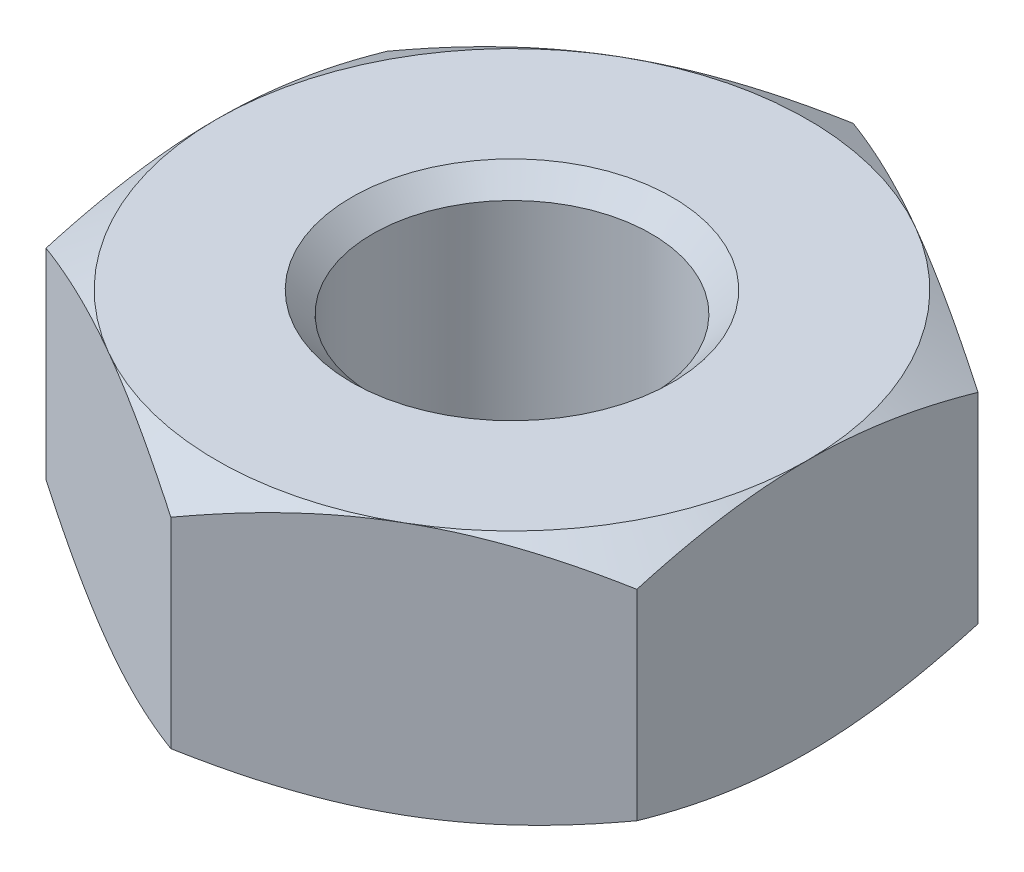
from build123d import *

# Parameters (mm, degrees)
BOSS_EXTRUDE1_DEPTH     = 1.5
SKETCH2_OUTSIDE_W       = 19.534
SKETCH2_OUTSIDE_H       = 20.616
SKETCH2_OUTSIDE_R       = 3.5
CUT_EXTRUDE1_DEPTH      = 2.4
CUT_EXTRUDE1_DRAFT      = -60
MIRROR1_COPY_1_SKETCH_W = 19.534
MIRROR1_COPY_1_SKETCH_H = 20.616
MIRROR1_COPY_1_SKETCH_R = 3.5
MIRROR1_COPY_1_DEPTH    = 2.4
MIRROR1_COPY_1_DRAFT    = -60
TAPPED_HOLE1_D          = 3.3
CHAMFER1_SIZE           = 0.25


with BuildPart() as part:
    # Sketch1 → Boss-Extrude1 (new, symmetric)
    with BuildSketch(Plane(origin=(0, 0, 0), x_dir=(1, 0, 0), z_dir=(0, 1, 0))):
        Polygon((3.5, -2.020725942), (3.5, 2.020725942), (0, 4.041451884), (-3.5, 2.020725942), (-3.5, -2.020725942), (0, -4.041451884), align=None)
    extrude(amount=BOSS_EXTRUDE1_DEPTH, both=True)


with BuildPart() as cut_extrude1_tool:
    # Sketch2 outside → Cut-Extrude1 (with draft: the straight prism first)
    with BuildSketch(Plane(origin=(0, 1.5, 0), x_dir=(1, 0, 0), z_dir=(0, 1, 0))):
        Rectangle(SKETCH2_OUTSIDE_W, SKETCH2_OUTSIDE_H)
        Circle(SKETCH2_OUTSIDE_R, mode=Mode.SUBTRACT)
    extrude(amount=-CUT_EXTRUDE1_DEPTH)
    # Cut-Extrude1: the draft: its side faces are tilted about the plane it starts from
    cut_extrude1_sides = [cut_extrude1_tool.faces().sort_by_distance(p)[0] for p in [
        (0, 0.3, 10.308),
        (9.767, 0.3, 0),
        (0, 0.3, -10.308),
        (-9.767, 0.3, 0),
        (-3.5, 0.3, 0),
    ]]
    draft(cut_extrude1_sides, Plane(origin=(0, 1.5, 0), x_dir=(1, 0, 0), z_dir=(0, 1, 0)), CUT_EXTRUDE1_DRAFT)


with BuildPart() as part_1:
    add(part.part)

    # Cut-Extrude1: cut by cut_extrude1_tool
    add(cut_extrude1_tool.part, mode=Mode.SUBTRACT)


with BuildPart() as mirror1_copy_1_tool:
    # Mirror1 copy 1 sketch → Mirror1 copy 1 (with draft: the straight prism first)
    with BuildSketch(Plane.XZ.offset(1.5)):
        Rectangle(MIRROR1_COPY_1_SKETCH_W, MIRROR1_COPY_1_SKETCH_H)
        Circle(MIRROR1_COPY_1_SKETCH_R, mode=Mode.SUBTRACT)
    extrude(amount=-MIRROR1_COPY_1_DEPTH)
    # Mirror1 copy 1: the draft: its side faces are tilted about the plane it starts from
    mirror1_copy_1_sides = [mirror1_copy_1_tool.faces().sort_by_distance(p)[0] for p in [
        (0, -0.3, 10.308),
        (9.767, -0.3, 0),
        (0, -0.3, -10.308),
        (-9.767, -0.3, 0),
        (-3.5, -0.3, 0),
    ]]
    draft(mirror1_copy_1_sides, Plane.XZ.offset(1.5), MIRROR1_COPY_1_DRAFT)


with BuildPart() as part_2:
    add(part_1.part)

    # Mirror1 copy 1: cut by mirror1_copy_1_tool
    add(mirror1_copy_1_tool.part, mode=Mode.SUBTRACT)

    # Tapped Hole1 (through all)
    with Locations(Plane(origin=(0, -1.5, 0), x_dir=(-1, 0, 0), z_dir=(0, -1, 0))):
        with Locations((0, 0)):
            Hole(TAPPED_HOLE1_D / 2)

    # Chamfer1
    chamfer1_edges = [part_2.edges().sort_by_distance(p)[0] for p in [
        (-1.65, -1.5, 0),
        (-1.65, 1.5, 0),
    ]]
    chamfer(chamfer1_edges, length=CHAMFER1_SIZE)


solid = part_2.part
